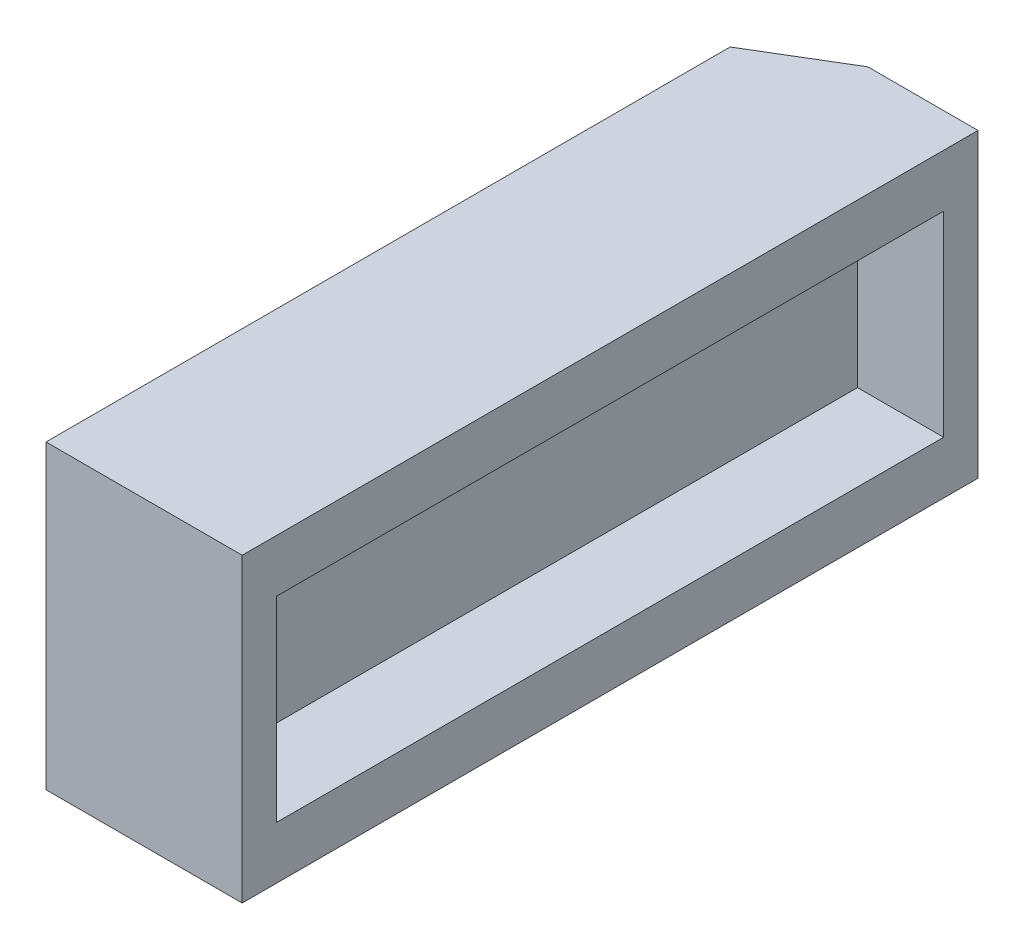
from build123d import *

# Parameters (mm, degrees)
SKETCH4_W           = 108.585
SKETCH4_H           = 44.45
SKETCH4_W_2         = 98.425
SKETCH4_H_2         = 28.9052
BOSS_EXTRUDE2_DEPTH = 12.7
SKETCH5_W           = 108.585
SKETCH5_H           = 44.45
BOSS_EXTRUDE3_DEPTH = 3.556
SKETCH6_W           = 100.965
SKETCH6_H           = 44.45
SKETCH6_W_2         = 90.805
SKETCH6_H_2         = 29.0576
BOSS_EXTRUDE4_DEPTH = 12.7
BOSS_EXTRUDE6_DEPTH = 7.6962
BOSS_EXTRUDE7_DEPTH = 7.6962
FILLET1_R           = 2.54


with BuildPart() as part:
    # Sketch4 → Boss-Extrude2 (new body)
    with BuildSketch(Plane(origin=(0, 0, 0), x_dir=(0, 0, -1), z_dir=(1, 0, 0))):
        with Locations((49.2125, 14.4526)):
            Rectangle(SKETCH4_W, SKETCH4_H)
        with Locations((49.2125, 14.4526)):
            Rectangle(SKETCH4_W_2, SKETCH4_H_2, mode=Mode.SUBTRACT)
    extrude(amount=BOSS_EXTRUDE2_DEPTH)

    # Sketch5 → Boss-Extrude3 (add)
    with BuildSketch(Plane.ZY):
        with Locations((-49.2125, 14.4526)):
            Rectangle(SKETCH5_W, SKETCH5_H)
    extrude(amount=BOSS_EXTRUDE3_DEPTH)

    # Sketch6 → Boss-Extrude4 (add)
    with BuildSketch(Plane.ZY.offset(3.556)):
        with Locations((-45.4025, 14.4526)):
            Rectangle(SKETCH6_W, SKETCH6_H)
        with Locations((-45.4025, 14.4526)):
            Rectangle(SKETCH6_W_2, SKETCH6_H_2, mode=Mode.SUBTRACT)
    extrude(amount=BOSS_EXTRUDE4_DEPTH)

    # Sketch7 → Boss-Extrude6 (add)
    with BuildSketch(Plane(origin=(0, 36.6776, 0), x_dir=(1, 0, 0), z_dir=(0, 1, 0))):
        Polygon((-3.556, 103.505), (-3.556, 95.885), (-16.256, 95.885), align=None)
    extrude(amount=-BOSS_EXTRUDE6_DEPTH)

    # Sketch8 → Boss-Extrude7 (add)
    with BuildSketch(Plane.XZ.offset(7.7724)):
        Polygon((-3.556, -103.505), (-3.556, -95.885), (-16.256, -95.885), align=None)
    extrude(amount=-BOSS_EXTRUDE7_DEPTH)

    # Fillet1
    fillet1_edges = [part.edges().sort_by_distance(p)[0] for p in [
        (-3.556, 14.4526, -95.885),
        (-9.906, 28.9814, -95.885),
        (-3.556, 28.9814, -99.695),
        (-3.556, -0.0762, -99.695),
        (-9.906, -0.0762, -95.885),
    ]]
    fillet(fillet1_edges, radius=FILLET1_R)


solid = part.part
